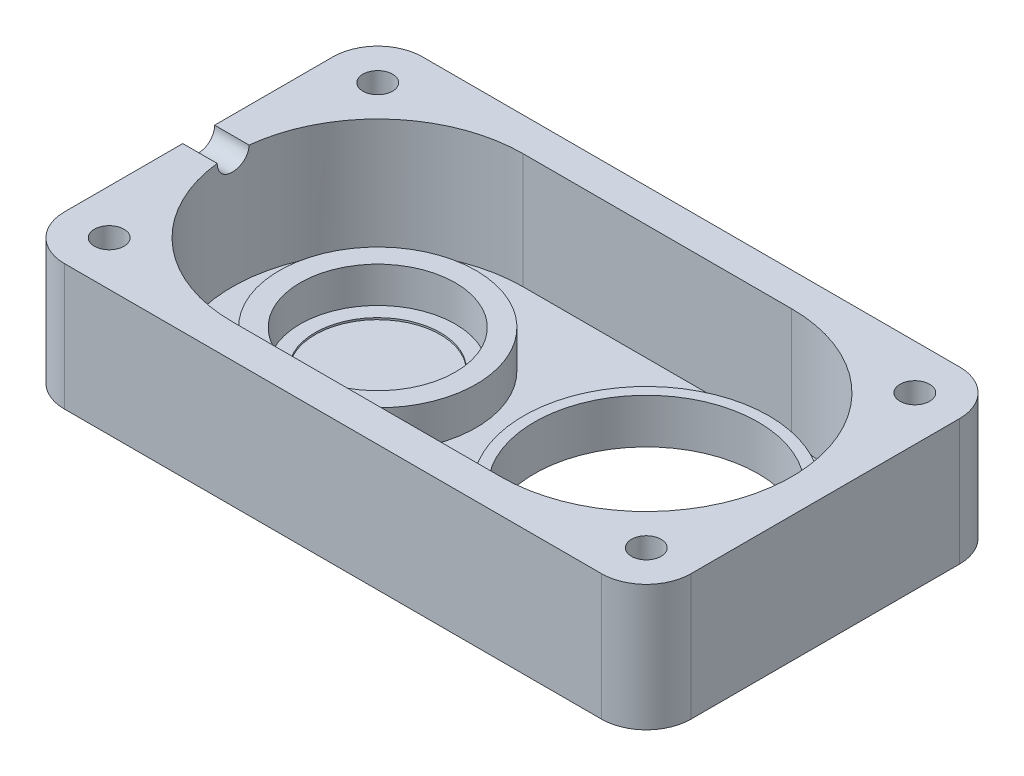
from build123d import *

# Parameters (mm, degrees)
SKETCH1_R               = 15.875
SKETCH1_R_2             = 2.1
BOSS_EXTRUDE1_DEPTH     = 17.87906
CUT_EXTRUDE1_DEPTH      = 16.35506
SKETCH3_R               = 13.97
SKETCH3_R_2             = 8.89
BOSS_EXTRUDE2_DEPTH     = 0.254
SKETCH4_R               = 13.97
SKETCH4_R_2             = 10.99947
BOSS_EXTRUDE3_DEPTH     = 5.08
SKETCH5_R               = 17.399
SKETCH5_R_2             = 15.875
BOSS_EXTRUDE4_DEPTH     = 4.826
CUT_EXTRUDE2_REACH      = 96.17
CUT_EXTRUDE2_END_RADIUS = 20.6375
SKETCH6_R               = 2.2606
SKETCH7_R               = 3.75
CUT_EXTRUDE3_DEPTH      = 4.5


with BuildPart() as part:
    # Sketch1 → Boss-Extrude1 (new body)
    with BuildSketch(Plane(origin=(0, 0, 0), x_dir=(1, 0, 0), z_dir=(0, 1, 0))):
        with BuildLine():
            Line((-19.05, -25.4), (57.15, -25.4))
            ThreePointArc((57.15, -25.4), (61.640128061, -23.540128061), (63.5, -19.05))
            Line((63.5, -19.05), (63.5, 19.05))
            ThreePointArc((63.5, 19.05), (61.640128061, 23.540128061), (57.15, 25.4))
            Line((57.15, 25.4), (-19.05, 25.4))
            ThreePointArc((-19.05, 25.4), (-23.540128061, 23.540128061), (-25.4, 19.05))
            Line((-25.4, 19.05), (-25.4, -19.05))
            ThreePointArc((-25.4, -19.05), (-23.540128061, -23.540128061), (-19.05, -25.4))
        make_face()
        with Locations(Location((38.1, 0, 0), (0, 0, 270))):
            Circle(SKETCH1_R, mode=Mode.SUBTRACT)
        with Locations(Location((-19.05, 19.05, 0), (0, 0, 270))):
            Circle(SKETCH1_R_2, mode=Mode.SUBTRACT)
        with Locations(Location((-19.05, -19.05, 0), (0, 0, 270))):
            Circle(SKETCH1_R_2, mode=Mode.SUBTRACT)
        with Locations(Location((57.15, -19.05, 0), (0, 0, 270))):
            Circle(SKETCH1_R_2, mode=Mode.SUBTRACT)
        with Locations(Location((57.15, 19.05, 0), (0, 0, 270))):
            Circle(SKETCH1_R_2, mode=Mode.SUBTRACT)
    extrude(amount=BOSS_EXTRUDE1_DEPTH)

    # Sketch2 → Cut-Extrude1 (cut)
    with BuildSketch(Plane(origin=(0, 17.87906, 0), x_dir=(1, 0, 0), z_dir=(0, 1, 0))):
        with BuildLine():
            Line((0, 20.6375), (38.1, 20.6375))
            ThreePointArc((38.1, 20.6375), (58.7375, 0), (38.1, -20.6375))
            Line((38.1, -20.6375), (0, -20.6375))
            ThreePointArc((0, -20.6375), (-20.6375, 0), (0, 20.6375))
        make_face()
    extrude(amount=-CUT_EXTRUDE1_DEPTH, mode=Mode.SUBTRACT)

    # Sketch3 → Boss-Extrude2 (add)
    with BuildSketch(Plane(origin=(0, 1.524, 0), x_dir=(1, 0, 0), z_dir=(0, 1, 0))):
        with Locations(Location((0, 0, 0), (0, 0, 90))):
            Circle(SKETCH3_R)
        with Locations(Location((0, 0, 0), (0, 0, 270))):
            Circle(SKETCH3_R_2, mode=Mode.SUBTRACT)
    extrude(amount=BOSS_EXTRUDE2_DEPTH)

    # Sketch4 → Boss-Extrude3 (add)
    with BuildSketch(Plane(origin=(0, 1.778, 0), x_dir=(1, 0, 0), z_dir=(0, 1, 0))):
        with Locations(Location((0, 0, 0), (0, 0, 90))):
            Circle(SKETCH4_R)
        with Locations(Location((0, 0, 0), (0, 0, 270))):
            Circle(SKETCH4_R_2, mode=Mode.SUBTRACT)
    extrude(amount=BOSS_EXTRUDE3_DEPTH)

    # Sketch5 → Boss-Extrude4 (add)
    with BuildSketch(Plane(origin=(0, 1.524, 0), x_dir=(1, 0, 0), z_dir=(0, 1, 0))):
        with Locations(Location((38.1, 0, 0), (0, 0, 90))):
            Circle(SKETCH5_R)
        with Locations(Location((38.1, 0, 0), (0, 0, 270))):
            Circle(SKETCH5_R_2, mode=Mode.SUBTRACT)
    extrude(amount=BOSS_EXTRUDE4_DEPTH)

    # Cut-Extrude2: up to this cylinder (the profile starts outside it)
    cut_extrude2_end = Plane(origin=(0, 17.87906, 0), z_dir=(0, 1, 0)) * Cylinder(CUT_EXTRUDE2_END_RADIUS, 234.615, mode=Mode.PRIVATE)
    # Sketch6 → Cut-Extrude2 (cut, up to the surface)
    with BuildSketch(Plane.ZY.offset(25.4), mode=Mode.PRIVATE) as cut_extrude2_sk1:
        with Locations((0, 17.87906)):
            Circle(SKETCH6_R)
    cut_extrude2_tool1 = extrude(cut_extrude2_sk1.sketch, amount=-CUT_EXTRUDE2_REACH, mode=Mode.PRIVATE) - cut_extrude2_end
    add(cut_extrude2_tool1.solids().sort_by_distance((-25.4, 17.87906, 0))[0], mode=Mode.SUBTRACT)

    # Sketch7 → Cut-Extrude3 (cut)
    with BuildSketch(Plane.XZ):
        with Locations(Location((-19.05, 19.05, 0), (0, 0, 270))):
            Circle(SKETCH7_R)
        with Locations(Location((-19.05, -19.05, 0), (0, 0, 270))):
            Circle(SKETCH7_R)
        with Locations(Location((57.15, -19.05, 0), (0, 0, 270))):
            Circle(SKETCH7_R)
        with Locations(Location((57.15, 19.05, 0), (0, 0, 270))):
            Circle(SKETCH7_R)
    extrude(amount=-CUT_EXTRUDE3_DEPTH, mode=Mode.SUBTRACT)


solid = part.part
